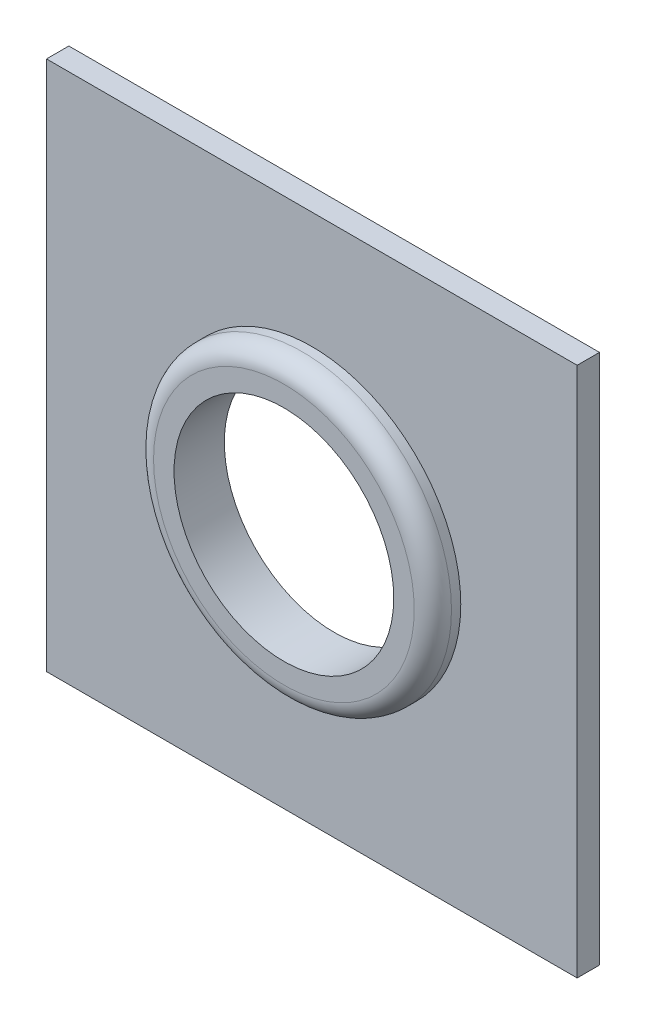
from build123d import *

# Parameters (mm, degrees)
SKETCH1_W           = 28.5
SKETCH1_H           = 28.5
SKETCH1_R           = 5.9
BOSS_EXTRUDE1_DEPTH = 1.2
SKETCH1_3_R         = 8
SKETCH1_3_R_2       = 5.9
BOSS_EXTRUDE2_DEPTH = 2.7
FILLET1_R           = 1


with BuildPart() as part:
    # Sketch1 → Boss-Extrude1 (new body)
    with BuildSketch(Plane.XY):
        Rectangle(SKETCH1_W, SKETCH1_H)
        Circle(SKETCH1_R, mode=Mode.SUBTRACT)
    extrude(amount=BOSS_EXTRUDE1_DEPTH)

    # Sketch1<3> → Boss-Extrude2 (add)
    with BuildSketch(Plane.XY):
        Circle(SKETCH1_3_R)
        Circle(SKETCH1_3_R_2, mode=Mode.SUBTRACT)
    extrude(amount=BOSS_EXTRUDE2_DEPTH)

    # Fillet1
    fillet1_edges = [part.edges().sort_by_distance(p)[0] for p in [
        (-8, 0, 2.7),
    ]]
    fillet(fillet1_edges, radius=FILLET1_R)


solid = part.part
